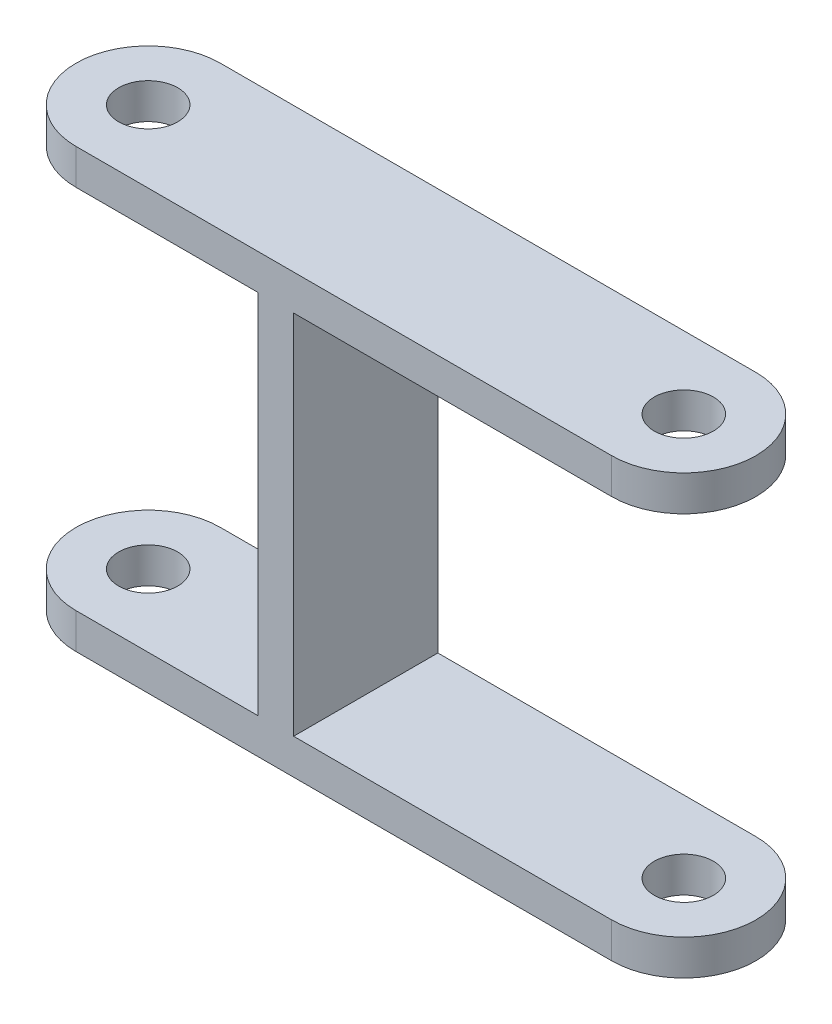
from build123d import *

# Parameters (mm, degrees)
SKETCH7_R           = 2.5
BOSS_EXTRUDE3_DEPTH = 37
SKETCH8_W           = 15.4
SKETCH8_H           = 31
SKETCH8_W_2         = 8.010366446
SKETCH8_W_3         = 36.155804789
CUT_EXTRUDE4_DEPTH  = 76.893008599


with BuildPart() as part:
    # Sketch7 → Boss-Extrude3 (new body)
    with BuildSketch(Plane(origin=(0, 0, 0), x_dir=(1, 0, 0), z_dir=(0, 1, 0))):
        with BuildLine():
            Line((13.729937465, 55.269451431), (59.029937465, 55.269451431))
            ThreePointArc((59.029937465, 55.269451431), (65.129937465, 49.169451431), (59.029937465, 43.069451431))
            Line((59.029937465, 43.069451431), (13.729937465, 43.069451431))
            ThreePointArc((13.729937465, 43.069451431), (7.629937465, 49.169451431), (13.729937465, 55.269451431))
        make_face()
        with Locations(Location((13.729937465, 49.169451431, 0), (0, 0, 270))):
            Circle(SKETCH7_R, mode=Mode.SUBTRACT)
        with Locations(Location((59.029937465, 49.169451431, 0), (0, 0, 270))):
            Circle(SKETCH7_R, mode=Mode.SUBTRACT)
    extrude(amount=BOSS_EXTRUDE3_DEPTH)

    # Sketch8 → Cut-Extrude4 (cut, through all)
    with BuildSketch(Plane(origin=(0, 0, -55.269451431), x_dir=(-1, 0, 0), z_dir=(0, 0, -1))):
        with Locations((-21.429937465, 18.5)):
            Rectangle(SKETCH8_W, SKETCH8_H)
        with Locations((-9.724754242, 18.5)):
            Rectangle(SKETCH8_W_2, SKETCH8_H)
        with Locations((-50.207839859, 18.5)):
            Rectangle(SKETCH8_W_3, SKETCH8_H)
    extrude(amount=-CUT_EXTRUDE4_DEPTH, mode=Mode.SUBTRACT)


solid = part.part
